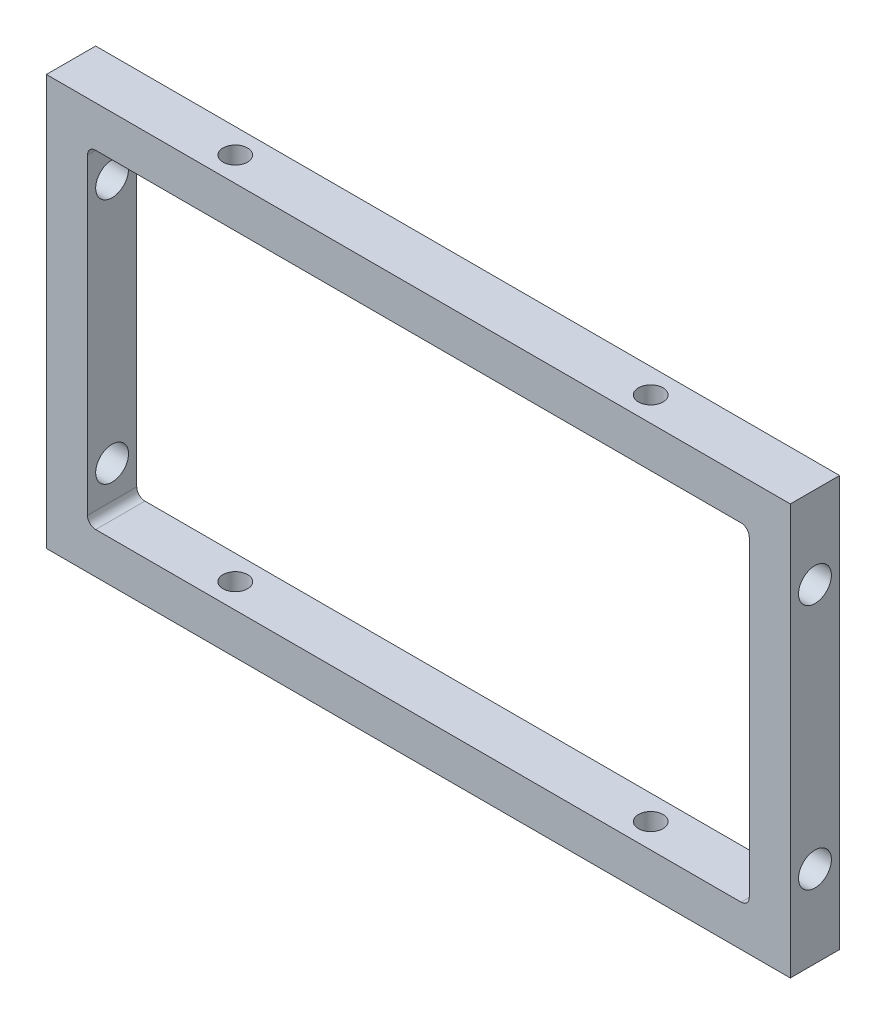
from build123d import *

# Parameters (mm, degrees)
SKETCH_1_W          = 90.6
SKETCH_1_H          = 50
SKETCH_1_W_2        = 80.6
SKETCH_1_H_2        = 40
EXTRUDE_1_DEPTH     = 6
FILLET_1_R          = 1
SKETCH_2_R          = 2
CUT_EXTRUDE_1_DEPTH = 95.177279638
SKETCH_3_R          = 1.5
CUT_EXTRUDE_2_DEPTH = 68.73544124


with BuildPart() as part:
    # 草图1 → 凸台-拉伸1 (new body)
    with BuildSketch(Plane.XY):
        Rectangle(SKETCH_1_W, SKETCH_1_H)
        Rectangle(SKETCH_1_W_2, SKETCH_1_H_2, mode=Mode.SUBTRACT)
    extrude(amount=EXTRUDE_1_DEPTH)

    # 圆角1
    fillet_1_edges = [part.edges().sort_by_distance(p)[0] for p in [
        (40.3, -20, 3),
        (40.3, 20, 3),
        (-40.3, 20, 3),
        (-40.3, -20, 3),
    ]]
    fillet(fillet_1_edges, radius=FILLET_1_R)

    # 草图2 → 切除-拉伸1 (cut, through all)
    with BuildSketch(Plane(origin=(45.3, 0, 0), x_dir=(0, 0, -1), z_dir=(1, 0, 0))):
        with Locations((-3, 15)):
            Circle(SKETCH_2_R)
        with Locations((-3, -15)):
            Circle(SKETCH_2_R)
    extrude(amount=-CUT_EXTRUDE_1_DEPTH, mode=Mode.SUBTRACT)

    # 草图3 → 切除-拉伸2 (cut, through all)
    with BuildSketch(Plane(origin=(0, 25, 0), x_dir=(1, 0, 0), z_dir=(0, 1, 0))):
        with Locations(Location((-25.3, -3, 0), (0, 0, 270))):
            Circle(SKETCH_3_R)
        with Locations(Location((25.3, -3, 0), (0, 0, 270))):
            Circle(SKETCH_3_R)
    extrude(amount=-CUT_EXTRUDE_2_DEPTH, mode=Mode.SUBTRACT)


solid = part.part
